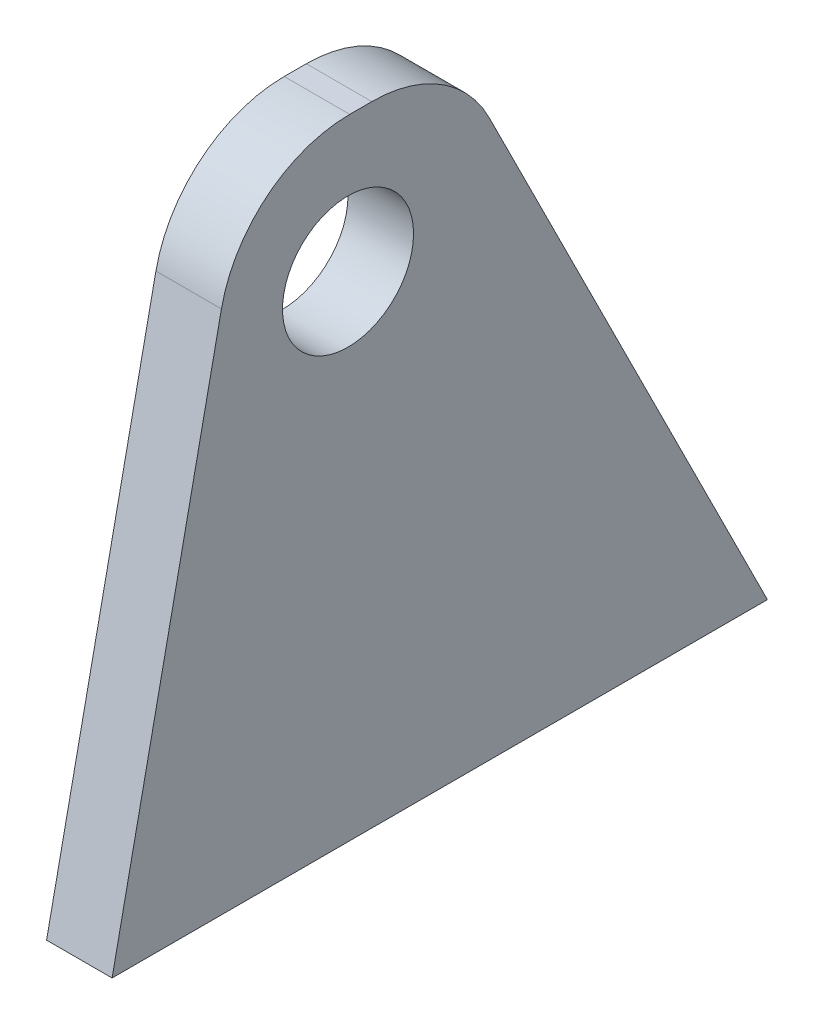
from build123d import *

# Parameters (mm, degrees)
SKETCH1_R           = 3.175
BOSS_EXTRUDE1_DEPTH = 3.175
FILLET2_R           = 6.35


with BuildPart() as part:
    # Sketch1 → Boss-Extrude1 (new body)
    with BuildSketch(Plane(origin=(0, 0, 0), x_dir=(0, 0, -1), z_dir=(1, 0, 0))):
        Polygon((31.75, 0), (16.51, 30.48), (6.35, 30.48), (0, 0), align=None)
        with Locations((11.43, 23.92807)):
            Circle(SKETCH1_R, mode=Mode.SUBTRACT)
    extrude(amount=BOSS_EXTRUDE1_DEPTH)

    # Fillet2
    fillet2_edges = [part.edges().sort_by_distance(p)[0] for p in [
        (1.5875, 30.48, -6.35),
        (1.5875, 30.48, -16.51),
    ]]
    fillet(fillet2_edges, radius=FILLET2_R)


solid = part.part
